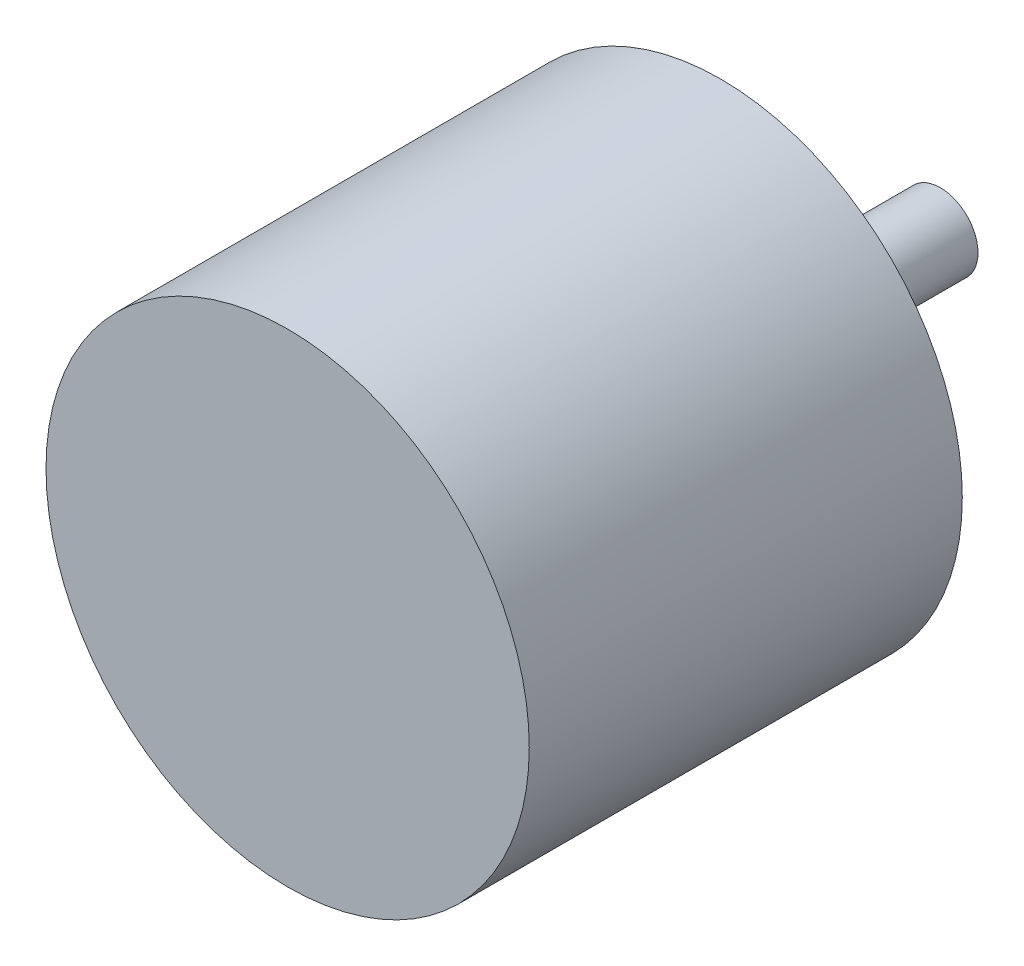
from build123d import *

# Parameters (mm, degrees)
SKETCH1_R           = 19.25
BOSS_EXTRUDE1_DEPTH = 34.5
SKETCH1_3_R         = 10
SKETCH1_3_R_2       = 3
BOSS_EXTRUDE2_DEPTH = 5
SKETCH1_4_R         = 3
BOSS_EXTRUDE3_DEPTH = 17.5


with BuildPart() as part:
    # Sketch1 → Boss-Extrude1 (new body)
    with BuildSketch(Plane.XY):
        Circle(SKETCH1_R)
    extrude(amount=BOSS_EXTRUDE1_DEPTH)

    # Sketch1<3> → Boss-Extrude2 (add)
    with BuildSketch(Plane.XY):
        Circle(SKETCH1_3_R)
        Circle(SKETCH1_3_R_2, mode=Mode.SUBTRACT)
    extrude(amount=-BOSS_EXTRUDE2_DEPTH)

    # Sketch1<4> → Boss-Extrude3 (add)
    with BuildSketch(Plane.XY):
        Circle(SKETCH1_4_R)
    extrude(amount=-BOSS_EXTRUDE3_DEPTH)


solid = part.part
